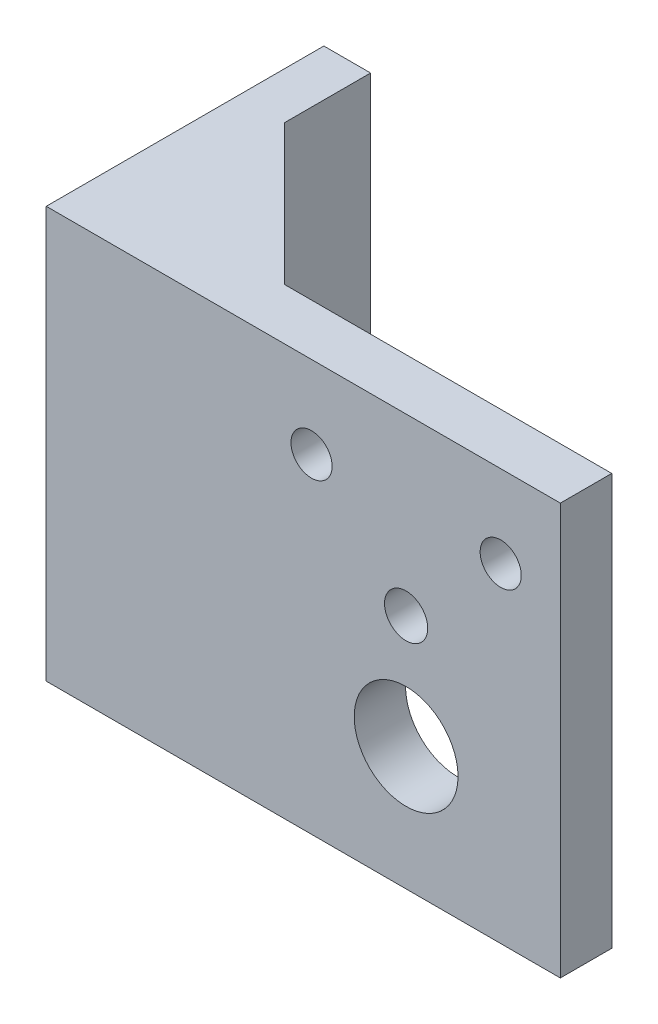
from build123d import *

# Parameters (mm, degrees)
BOSS_EXTRUDE1_DEPTH = 40
CUT_EXTRUDE1_DEPTH  = 35
BOSS_EXTRUDE2_DEPTH = 5
SKETCH6_R           = 2
CUT_EXTRUDE2_DEPTH  = 70.936511941
SKETCH7_R           = 3.1
SKETCH7_R_2         = 2.1
SKETCH7_R_3         = 2
CUT_EXTRUDE4_DEPTH  = 71.710678119
SKETCH8_R           = 5.05
CUT_EXTRUDE5_DEPTH  = 73.972597597
SKETCH10_W          = 8
SKETCH10_H          = 40
CUT_EXTRUDE8_DEPTH  = 70.936511941


with BuildPart() as part:
    # Sketch1 → Boss-Extrude1 (new body)
    with BuildSketch(Plane(origin=(0, 0, 0), x_dir=(1, 0, 0), z_dir=(0, 1, 0))):
        Polygon((0, 0), (50, 0), (50, 5), (18.181818182, 5), (4.545454545, 18.636363636), (4.545454545, 35), (0, 35), align=None)
    extrude(amount=BOSS_EXTRUDE1_DEPTH)

    # Sketch3 → Cut-Extrude1 (cut)
    with BuildSketch(Plane.XZ):
        Polygon((4.545454545, -18.636363636), (4.545454545, -5), (18.181818182, -5), align=None)
    extrude(amount=-CUT_EXTRUDE1_DEPTH, mode=Mode.SUBTRACT)

    # Sketch5 → Boss-Extrude2 (add)
    with BuildSketch(Plane.XZ):
        Polygon((4.545454545, -20), (4.545454545, -5), (20, -5), align=None)
    extrude(amount=-BOSS_EXTRUDE2_DEPTH)

    # Sketch6 → Cut-Extrude2 (cut, through all)
    with BuildSketch(Plane(origin=(4.545454545, 0, 0), x_dir=(0, 0, -1), z_dir=(1, 0, 0))):
        with Locations((13, 30)):
            Circle(SKETCH6_R)
        with Locations((13, 10)):
            Circle(SKETCH6_R)
        with Locations((21, 20)):
            Circle(SKETCH6_R)
    extrude(amount=-CUT_EXTRUDE2_DEPTH, mode=Mode.SUBTRACT)

    # Sketch7 → Cut-Extrude4 (cut, through all)
    with BuildSketch(Plane(origin=(0, 0, -5), x_dir=(-1, 0, 0), z_dir=(0, 0, -1))):
        with Locations((-35, 12)):
            Circle(SKETCH7_R)
        with Locations((-35, 23)):
            Circle(SKETCH7_R_2)
        with Locations((-25.8, 32)):
            Circle(SKETCH7_R_3)
        with Locations((-44.2, 32)):
            Circle(SKETCH7_R_3)
    extrude(amount=-CUT_EXTRUDE4_DEPTH, mode=Mode.SUBTRACT)

    # Sketch8 → Cut-Extrude5 (cut, through all)
    with BuildSketch(Plane.XY):
        with Locations((35, 12)):
            Circle(SKETCH8_R)
    extrude(amount=-CUT_EXTRUDE5_DEPTH, mode=Mode.SUBTRACT)

    # Sketch10 → Cut-Extrude8 (cut, through all)
    with BuildSketch(Plane(origin=(4.545454545, 0, 0), x_dir=(0, 0, -1), z_dir=(1, 0, 0))):
        with Locations((31, 20)):
            Rectangle(SKETCH10_W, SKETCH10_H)
    extrude(amount=-CUT_EXTRUDE8_DEPTH, mode=Mode.SUBTRACT)


solid = part.part
